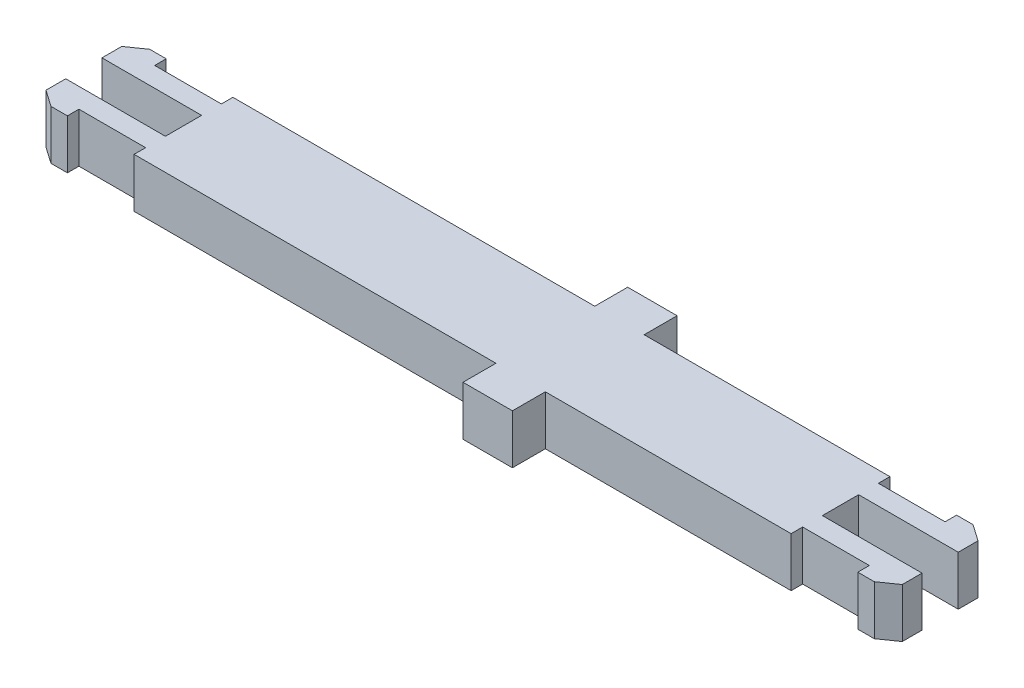
from build123d import *

# Parameters (mm, degrees)
BOSS_EXTRUDE1_DEPTH = 3


with BuildPart() as part:
    # Sketch1 → Boss-Extrude1 (new body)
    with BuildSketch(Plane(origin=(0, 0, 0), x_dir=(1, 0, 0), z_dir=(0, 1, 0))):
        Polygon((-19.95, 3), (2.025, 3), (2.025, 5), (5.025, 5), (5.025, 3), (19.95, 3), (19.95, 2.3), (24, 2.3), (24, 3), (25, 3), (26, 2.3), (26, 1.1), (19.95, 1.1), (19.95, -1.1), (26, -1.1), (26, -2.3), (25, -3), (24, -3), (24, -2.3), (19.95, -2.3), (19.95, -3), (5.025, -3), (5.025, -5), (2.025, -5), (2.025, -3), (-19.95, -3), (-19.95, -2.3), (-24, -2.3), (-24, -3), (-25, -3), (-26, -2.3), (-26, -1.1), (-19.95, -1.1), (-19.95, 1.1), (-26, 1.1), (-26, 2.3), (-25, 3), (-24, 3), (-24, 2.3), (-19.95, 2.3), align=None)
    extrude(amount=BOSS_EXTRUDE1_DEPTH)


solid = part.part
